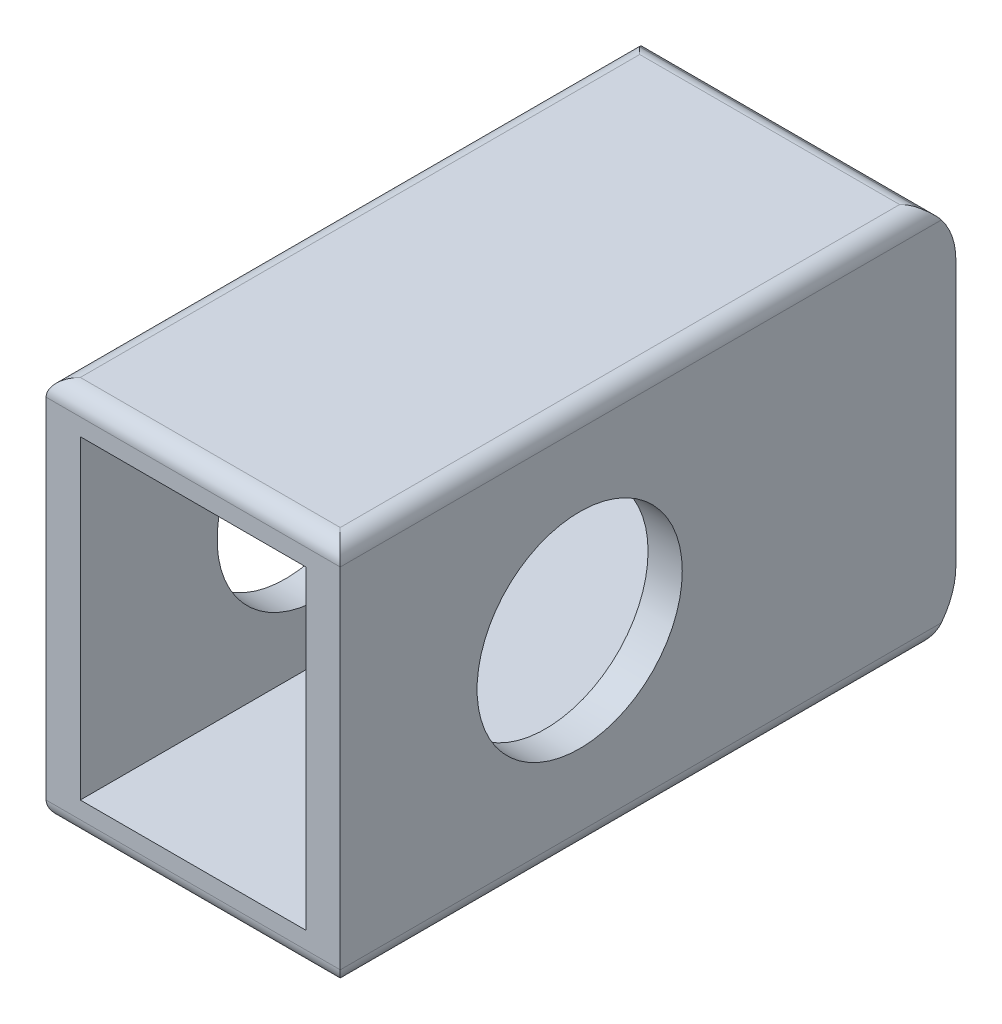
from build123d import *

# Parameters (mm, degrees)
ESQUISSE1_W             = 8.6
ESQUISSE1_H             = 11.2
BOSS_EXTRU_1_DEPTH      = 18
COQUE1_T                = -1
ESQUISSE2_R             = 3
ENL_V_MAT_EXTRU_1_DEPTH = 20
CONG_2_R                = 0.5


with BuildPart() as part:
    # Esquisse1 → Boss.-Extru.1 (new body)
    with BuildSketch(Plane.XY):
        with Locations((-0.468112778, -1.663701506)):
            Rectangle(ESQUISSE1_W, ESQUISSE1_H)
    extrude(amount=BOSS_EXTRU_1_DEPTH)

    # Coque1
    coque1_openings = [part.faces().sort_by_distance(p)[0] for p in [
        (-0.468112778, -1.663701506, 18),
    ]]
    offset(amount=COQUE1_T, openings=coque1_openings, kind=Kind.INTERSECTION)

    # Esquisse2 → Enlèv. mat.-Extru.1 (cut)
    with BuildSketch(Plane(origin=(3.831887222, 0, 0), x_dir=(0, 0, -1), z_dir=(1, 0, 0))):
        with BuildLine():
            ThreePointArc((-1, 3.936298494), (-0.267949192, 3.204247687), (0, 2.204247687))
            Line((0, 2.204247687), (0, 3.936298494))
            Line((0, 3.936298494), (-1, 3.936298494))
        make_face()
        with BuildLine():
            Line((-1, -7.263701506), (0, -7.263701506))
            Line((0, -7.263701506), (0, -5.531650698))
            ThreePointArc((0, -5.531650698), (-0.267949192, -6.531650698), (-1, -7.263701506))
        make_face()
        with Locations((-11, -1.663701506)):
            Circle(ESQUISSE2_R)
    extrude(amount=-ENL_V_MAT_EXTRU_1_DEPTH, mode=Mode.SUBTRACT)

    # Congé2
    cong_2_edges = [part.edges().sort_by_distance(p)[0] for p in [
        (-0.468112778, 3.936298494, 18),
        (-0.468112778, 3.936298494, 1),
        (-0.468112778, -7.263701506, 1),
        (-4.768112778, 3.936298494, 9.5),
        (3.831887222, 3.936298494, 9.5),
        (3.831887222, -7.263701506, 9.5),
        (-4.768112778, -7.263701506, 9.5),
        (-0.468112778, -7.263701506, 18),
    ]]
    fillet(cong_2_edges, radius=CONG_2_R)


solid = part.part
